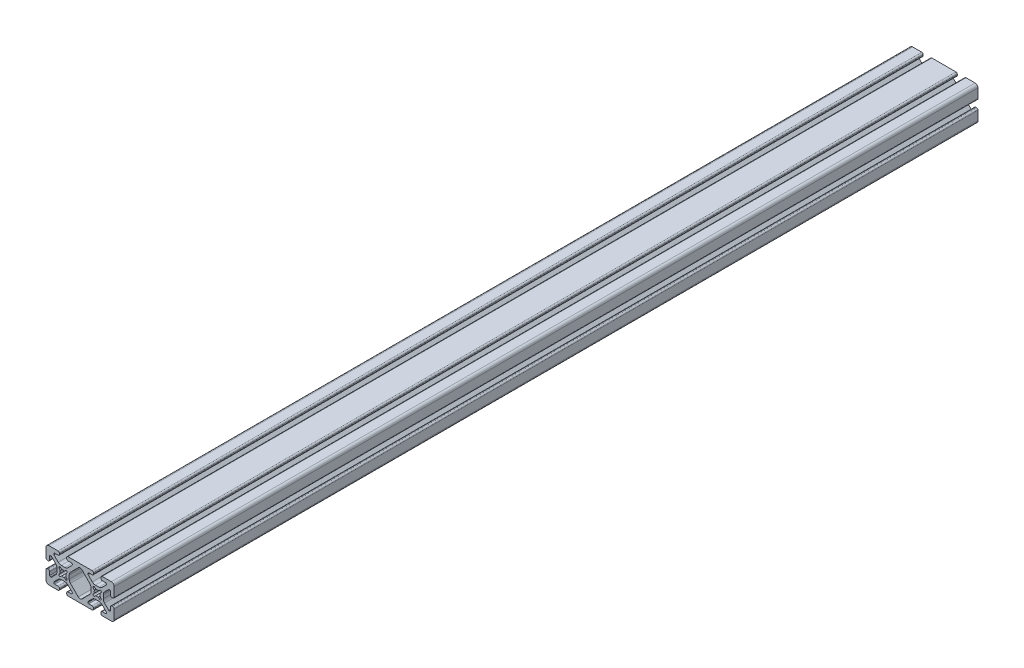
from build123d import *

# Parameters (mm, degrees)
BOSS_EXTRUDE1_DEPTH   = 965.2
BODY_MOVE_COPY2_ANGLE = 90


with BuildPart() as part:
    # Sketch1 → Boss-Extrude1 (new body)
    with BuildSketch(Plane(origin=(0, 0, -25.4), x_dir=(-1, 0, 0), z_dir=(0, 0, -1))):
        with BuildLine():
            Line((17.4752, 34.036), (16.5608, 34.036))
            ThreePointArc((16.5608, 34.036), (15.447248241, 33.574751759), (14.986, 32.4612))
            Line((14.986, 32.4612), (14.986, 28.702))
            ThreePointArc((14.986, 28.702), (14.725617928, 28.073382072), (14.097, 27.813))
            Line((14.097, 27.813), (13.528917816, 27.813))
            ThreePointArc((13.528917816, 27.813), (13.188712244, 27.880671096), (12.900299887, 28.073382072))
            Line((12.900299887, 28.073382072), (8.260840398, 32.712841561))
            ThreePointArc((8.260840398, 32.712841561), (7.231213183, 34.253787583), (6.869656187, 36.07145735))
            Line((6.869656187, 36.07145735), (6.869656187, 40.12854265))
            ThreePointArc((6.869656187, 40.12854265), (7.231213183, 41.946212417), (8.260840398, 43.487158439))
            Line((8.260840398, 43.487158439), (12.900299887, 48.126617928))
            ThreePointArc((12.900299887, 48.126617928), (13.188712244, 48.319328904), (13.528917816, 48.387))
            Line((13.528917816, 48.387), (14.097, 48.387))
            ThreePointArc((14.097, 48.387), (14.725617928, 48.126617928), (14.986, 47.498))
            Line((14.986, 47.498), (14.986, 43.7388))
            ThreePointArc((14.986, 43.7388), (15.447248241, 42.625248241), (16.5608, 42.164))
            Line((16.5608, 42.164), (17.4752, 42.164))
            ThreePointArc((17.4752, 42.164), (18.588751759, 42.625248241), (19.05, 43.7388))
            Line((19.05, 43.7388), (19.05, 53.975))
            ThreePointArc((19.05, 53.975), (18.12006403, 56.22006403), (15.875, 57.15))
            Line((15.875, 57.15), (5.6388, 57.15))
            ThreePointArc((5.6388, 57.15), (4.525248241, 56.688751759), (4.064, 55.5752))
            Line((4.064, 55.5752), (4.064, 54.6608))
            ThreePointArc((4.064, 54.6608), (4.525248241, 53.547248241), (5.6388, 53.086))
            Line((5.6388, 53.086), (9.398, 53.086))
            ThreePointArc((9.398, 53.086), (10.026617928, 52.825617928), (10.287, 52.197))
            Line((10.287, 52.197), (10.287, 51.628917816))
            ThreePointArc((10.287, 51.628917816), (10.219328904, 51.288712244), (10.026617928, 51.000299887))
            Line((10.026617928, 51.000299887), (5.387158439, 46.360840398))
            ThreePointArc((5.387158439, 46.360840398), (3.846212417, 45.331213183), (2.02854265, 44.969656187))
            Line((2.02854265, 44.969656187), (-2.02854265, 44.969656187))
            ThreePointArc((-2.02854265, 44.969656187), (-3.846212417, 45.331213183), (-5.387158439, 46.360840398))
            Line((-5.387158439, 46.360840398), (-10.026617928, 51.000299887))
            ThreePointArc((-10.026617928, 51.000299887), (-10.219328904, 51.288712244), (-10.287, 51.628917816))
            Line((-10.287, 51.628917816), (-10.287, 52.197))
            ThreePointArc((-10.287, 52.197), (-10.026617928, 52.825617928), (-9.398, 53.086))
            Line((-9.398, 53.086), (-5.6388, 53.086))
            ThreePointArc((-5.6388, 53.086), (-4.525248241, 53.547248241), (-4.064, 54.6608))
            Line((-4.064, 54.6608), (-4.064, 55.5752))
            ThreePointArc((-4.064, 55.5752), (-4.525248241, 56.688751759), (-5.6388, 57.15))
            Line((-5.6388, 57.15), (-15.875, 57.15))
            ThreePointArc((-15.875, 57.15), (-18.12006403, 56.22006403), (-19.05, 53.975))
            Line((-19.05, 53.975), (-19.05, 43.7388))
            ThreePointArc((-19.05, 43.7388), (-18.588751759, 42.625248241), (-17.4752, 42.164))
            Line((-17.4752, 42.164), (-16.5608, 42.164))
            ThreePointArc((-16.5608, 42.164), (-15.447248241, 42.625248241), (-14.986, 43.7388))
            Line((-14.986, 43.7388), (-14.986, 47.498))
            ThreePointArc((-14.986, 47.498), (-14.725617928, 48.126617928), (-14.097, 48.387))
            Line((-14.097, 48.387), (-13.528917816, 48.387))
            ThreePointArc((-13.528917816, 48.387), (-13.188712244, 48.319328904), (-12.900299887, 48.126617928))
            Line((-12.900299887, 48.126617928), (-8.260840398, 43.487158439))
            ThreePointArc((-8.260840398, 43.487158439), (-7.231213183, 41.946212417), (-6.869656187, 40.12854265))
            Line((-6.869656187, 40.12854265), (-6.869656187, 36.07145735))
            ThreePointArc((-6.869656187, 36.07145735), (-7.231213183, 34.253787583), (-8.260840398, 32.712841561))
            Line((-8.260840398, 32.712841561), (-12.900299887, 28.073382072))
            ThreePointArc((-12.900299887, 28.073382072), (-13.188712244, 27.880671096), (-13.528917816, 27.813))
            Line((-13.528917816, 27.813), (-14.097, 27.813))
            ThreePointArc((-14.097, 27.813), (-14.725617928, 28.073382072), (-14.986, 28.702))
            Line((-14.986, 28.702), (-14.986, 32.4612))
            ThreePointArc((-14.986, 32.4612), (-15.447248241, 33.574751759), (-16.5608, 34.036))
            Line((-16.5608, 34.036), (-17.4752, 34.036))
            ThreePointArc((-17.4752, 34.036), (-18.588751759, 33.574751759), (-19.05, 32.4612))
            Line((-19.05, 32.4612), (-19.05, 5.6388))
            ThreePointArc((-19.05, 5.6388), (-18.588751759, 4.525248241), (-17.4752, 4.064))
            Line((-17.4752, 4.064), (-16.5608, 4.064))
            ThreePointArc((-16.5608, 4.064), (-15.447248241, 4.525248241), (-14.986, 5.6388))
            Line((-14.986, 5.6388), (-14.986, 9.398))
            ThreePointArc((-14.986, 9.398), (-14.725617928, 10.026617928), (-14.097, 10.287))
            Line((-14.097, 10.287), (-13.528917816, 10.287))
            ThreePointArc((-13.528917816, 10.287), (-13.188712244, 10.219328904), (-12.900299887, 10.026617928))
            Line((-12.900299887, 10.026617928), (-8.260840398, 5.387158439))
            ThreePointArc((-8.260840398, 5.387158439), (-7.231213183, 3.846212417), (-6.869656187, 2.02854265))
            Line((-6.869656187, 2.02854265), (-6.869656187, -2.02854265))
            ThreePointArc((-6.869656187, -2.02854265), (-7.231213183, -3.846212417), (-8.260840398, -5.387158439))
            Line((-8.260840398, -5.387158439), (-12.900299887, -10.026617928))
            ThreePointArc((-12.900299887, -10.026617928), (-13.188712244, -10.219328904), (-13.528917816, -10.287))
            Line((-13.528917816, -10.287), (-14.097, -10.287))
            ThreePointArc((-14.097, -10.287), (-14.725617928, -10.026617928), (-14.986, -9.398))
            Line((-14.986, -9.398), (-14.986, -5.6388))
            ThreePointArc((-14.986, -5.6388), (-15.447248241, -4.525248241), (-16.5608, -4.064))
            Line((-16.5608, -4.064), (-17.4752, -4.064))
            ThreePointArc((-17.4752, -4.064), (-18.588751759, -4.525248241), (-19.05, -5.6388))
            Line((-19.05, -5.6388), (-19.05, -15.875))
            ThreePointArc((-19.05, -15.875), (-18.12006403, -18.12006403), (-15.875, -19.05))
            Line((-15.875, -19.05), (-5.6388, -19.05))
            ThreePointArc((-5.6388, -19.05), (-4.525248241, -18.588751759), (-4.064, -17.4752))
            Line((-4.064, -17.4752), (-4.064, -16.5608))
            ThreePointArc((-4.064, -16.5608), (-4.525248241, -15.447248241), (-5.6388, -14.986))
            Line((-5.6388, -14.986), (-9.398, -14.986))
            ThreePointArc((-9.398, -14.986), (-10.026617928, -14.725617928), (-10.287, -14.097))
            Line((-10.287, -14.097), (-10.287, -13.528917816))
            ThreePointArc((-10.287, -13.528917816), (-10.219328904, -13.188712244), (-10.026617928, -12.900299887))
            Line((-10.026617928, -12.900299887), (-5.387158439, -8.260840398))
            ThreePointArc((-5.387158439, -8.260840398), (-3.846212417, -7.231213183), (-2.02854265, -6.869656187))
            Line((-2.02854265, -6.869656187), (2.02854265, -6.869656187))
            ThreePointArc((2.02854265, -6.869656187), (3.846212417, -7.231213183), (5.387158439, -8.260840398))
            Line((5.387158439, -8.260840398), (10.026617928, -12.900299887))
            ThreePointArc((10.026617928, -12.900299887), (10.219328904, -13.188712244), (10.287, -13.528917816))
            Line((10.287, -13.528917816), (10.287, -14.097))
            ThreePointArc((10.287, -14.097), (10.026617928, -14.725617928), (9.398, -14.986))
            Line((9.398, -14.986), (5.6388, -14.986))
            ThreePointArc((5.6388, -14.986), (4.525248241, -15.447248241), (4.064, -16.5608))
            Line((4.064, -16.5608), (4.064, -17.4752))
            ThreePointArc((4.064, -17.4752), (4.525248241, -18.588751759), (5.6388, -19.05))
            Line((5.6388, -19.05), (15.875, -19.05))
            ThreePointArc((15.875, -19.05), (18.12006403, -18.12006403), (19.05, -15.875))
            Line((19.05, -15.875), (19.05, -5.6388))
            ThreePointArc((19.05, -5.6388), (18.588751759, -4.525248241), (17.4752, -4.064))
            Line((17.4752, -4.064), (16.5608, -4.064))
            ThreePointArc((16.5608, -4.064), (15.447248241, -4.525248241), (14.986, -5.6388))
            Line((14.986, -5.6388), (14.986, -9.398))
            ThreePointArc((14.986, -9.398), (14.725617928, -10.026617928), (14.097, -10.287))
            Line((14.097, -10.287), (13.528917816, -10.287))
            ThreePointArc((13.528917816, -10.287), (13.188712244, -10.219328904), (12.900299887, -10.026617928))
            Line((12.900299887, -10.026617928), (8.260840398, -5.387158439))
            ThreePointArc((8.260840398, -5.387158439), (7.231213183, -3.846212417), (6.869656187, -2.02854265))
            Line((6.869656187, -2.02854265), (6.869656187, 2.02854265))
            ThreePointArc((6.869656187, 2.02854265), (7.231213183, 3.846212417), (8.260840398, 5.387158439))
            Line((8.260840398, 5.387158439), (12.900299887, 10.026617928))
            ThreePointArc((12.900299887, 10.026617928), (13.188712244, 10.219328904), (13.528917816, 10.287))
            Line((13.528917816, 10.287), (14.097, 10.287))
            ThreePointArc((14.097, 10.287), (14.725617928, 10.026617928), (14.986, 9.398))
            Line((14.986, 9.398), (14.986, 5.6388))
            ThreePointArc((14.986, 5.6388), (15.447248241, 4.525248241), (16.5608, 4.064))
            Line((16.5608, 4.064), (17.4752, 4.064))
            ThreePointArc((17.4752, 4.064), (18.588751759, 4.525248241), (19.05, 5.6388))
            Line((19.05, 5.6388), (19.05, 32.4612))
            ThreePointArc((19.05, 32.4612), (18.588751759, 33.574751759), (17.4752, 34.036))
        make_face()
        with BuildLine():
            Line((5.387158439, 29.839159602), (14.110859133, 21.115458908))
            ThreePointArc((14.110859133, 21.115458908), (14.966400226, 19.05), (14.110859133, 16.984541092))
            Line((14.110859133, 16.984541092), (5.387158439, 8.260840398))
            ThreePointArc((5.387158439, 8.260840398), (3.846212417, 7.231213183), (2.02854265, 6.869656187))
            Line((2.02854265, 6.869656187), (-2.02854265, 6.869656187))
            ThreePointArc((-2.02854265, 6.869656187), (-3.846212417, 7.231213183), (-5.387158439, 8.260840398))
            Line((-5.387158439, 8.260840398), (-14.110859133, 16.984541092))
            ThreePointArc((-14.110859133, 16.984541092), (-14.966400226, 19.05), (-14.110859133, 21.115458908))
            Line((-14.110859133, 21.115458908), (-5.387158439, 29.839159602))
            ThreePointArc((-5.387158439, 29.839159602), (-3.846212417, 30.868786817), (-2.02854265, 31.230343813))
            Line((-2.02854265, 31.230343813), (2.02854265, 31.230343813))
            ThreePointArc((2.02854265, 31.230343813), (3.846212417, 30.868786817), (5.387158439, 29.839159602))
        make_face(mode=Mode.SUBTRACT)
        with BuildLine():
            Line((1.401430967, 3.017877069), (2.72685484, 4.343300942))
            ThreePointArc((2.72685484, 4.343300942), (4.343300937, 4.343300943), (4.34330094, 2.726854846))
            Line((4.34330094, 2.726854846), (3.017877069, 1.401430967))
            ThreePointArc((3.017877069, 1.401430967), (3.3274, 9e-09), (3.017877077, -1.40143095))
            Line((3.017877077, -1.40143095), (4.343300961, -2.726854828))
            ThreePointArc((4.343300961, -2.726854828), (4.343300966, -4.343300942), (2.726854852, -4.343300946))
            Line((2.726854852, -4.343300946), (1.401430967, -3.017877069))
            ThreePointArc((1.401430967, -3.017877069), (9e-09, -3.3274), (-1.40143095, -3.017877077))
            Line((-1.40143095, -3.017877077), (-2.726854834, -4.343300967))
            ThreePointArc((-2.726854834, -4.343300967), (-4.343300953, -4.343300971), (-4.343300954, -2.726854852))
            Line((-4.343300954, -2.726854852), (-3.017877069, -1.401430967))
            ThreePointArc((-3.017877069, -1.401430967), (-3.3274, -9e-09), (-3.017877077, 1.40143095))
            Line((-3.017877077, 1.40143095), (-4.343300961, 2.726854828))
            ThreePointArc((-4.343300961, 2.726854828), (-4.343300966, 4.343300942), (-2.726854852, 4.343300946))
            Line((-2.726854852, 4.343300946), (-1.401430967, 3.017877069))
            ThreePointArc((-1.401430967, 3.017877069), (0, 3.3274), (1.401430967, 3.017877069))
        make_face(mode=Mode.SUBTRACT)
        with BuildLine():
            Line((3.017877073, 36.698569024), (4.343300948, 35.373145156))
            ThreePointArc((4.343300948, 35.373145156), (4.343300954, 33.756699073), (2.726854871, 33.756699063))
            Line((2.726854871, 33.756699063), (1.401430985, 35.082122929))
            ThreePointArc((1.401430985, 35.082122929), (2.9e-08, 34.772599992), (-1.401430933, 35.082122908))
            Line((-1.401430933, 35.082122908), (-2.726854762, 33.756699066))
            ThreePointArc((-2.726854762, 33.756699066), (-4.343300901, 33.75669906), (-4.343300903, 35.373145199))
            Line((-4.343300903, 35.373145199), (-3.017877069, 36.698569033))
            ThreePointArc((-3.017877069, 36.698569033), (-3.327399996, 38.099999979), (-3.017877079, 39.501430928))
            Line((-3.017877079, 39.501430928), (-4.343300948, 40.826854777))
            ThreePointArc((-4.343300948, 40.826854777), (-4.343300957, 42.443300899), (-2.726854835, 42.443300905))
            Line((-2.726854835, 42.443300905), (-1.401430977, 41.117877054))
            ThreePointArc((-1.401430977, 41.117877054), (-8e-09, 41.427399992), (1.401430963, 41.117877065))
            Line((1.401430963, 41.117877065), (2.726854864, 42.443300966))
            ThreePointArc((2.726854864, 42.443300966), (4.343300963, 42.443300968), (4.343300969, 40.826854869))
            Line((4.343300969, 40.826854869), (3.017877073, 39.501430959))
            ThreePointArc((3.017877073, 39.501430959), (3.327400004, 38.099999992), (3.017877073, 36.698569024))
        make_face(mode=Mode.SUBTRACT)
    extrude(amount=-BOSS_EXTRUDE1_DEPTH)


with BuildPart() as part_1:
    # Body-Move/Copy2: moved
    add(part.part.rotate(Axis((0, 7.916627464, 0), (0, 0, 1)), BODY_MOVE_COPY2_ANGLE))


solid = part_1.part
